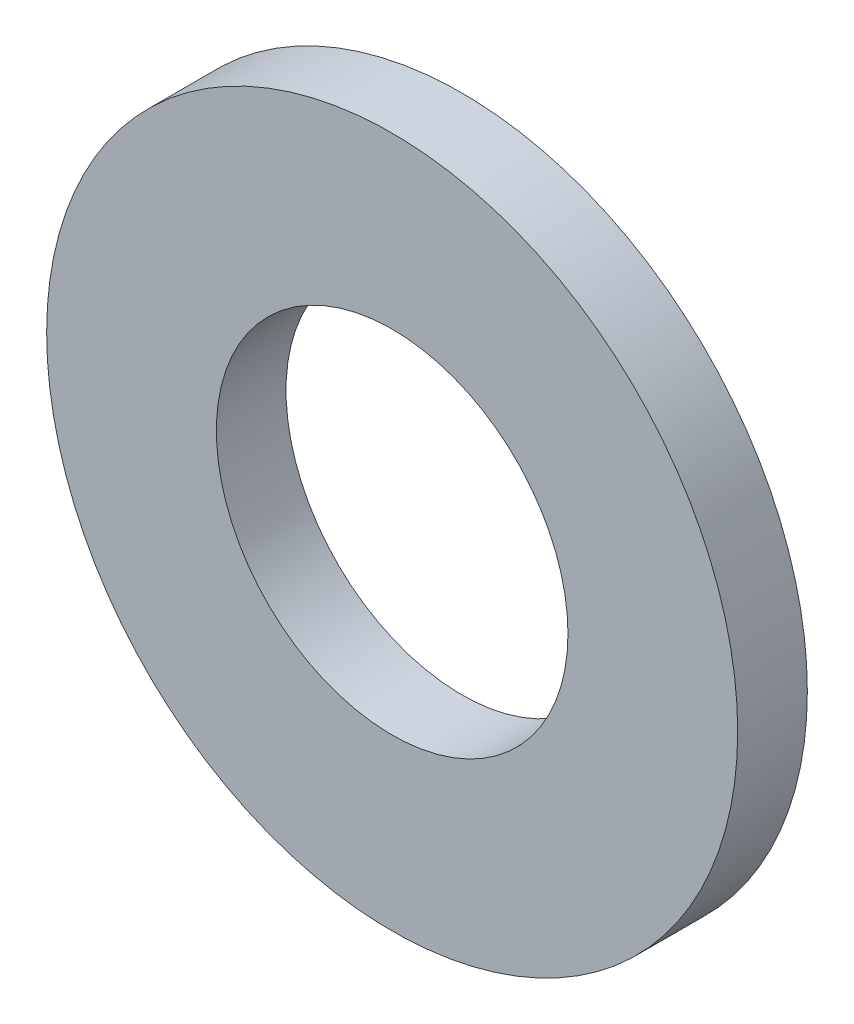
from build123d import *

# Parameters (mm, degrees)
SKETCH1_R           = 7.9375
SKETCH1_R_2         = 4.0386
BOSS_EXTRUDE1_DEPTH = 1.6002


with BuildPart() as part:
    # Sketch1 → Boss-Extrude1 (new body)
    with BuildSketch(Plane.XY):
        Circle(SKETCH1_R)
        Circle(SKETCH1_R_2, mode=Mode.SUBTRACT)
    extrude(amount=BOSS_EXTRUDE1_DEPTH)


solid = part.part
